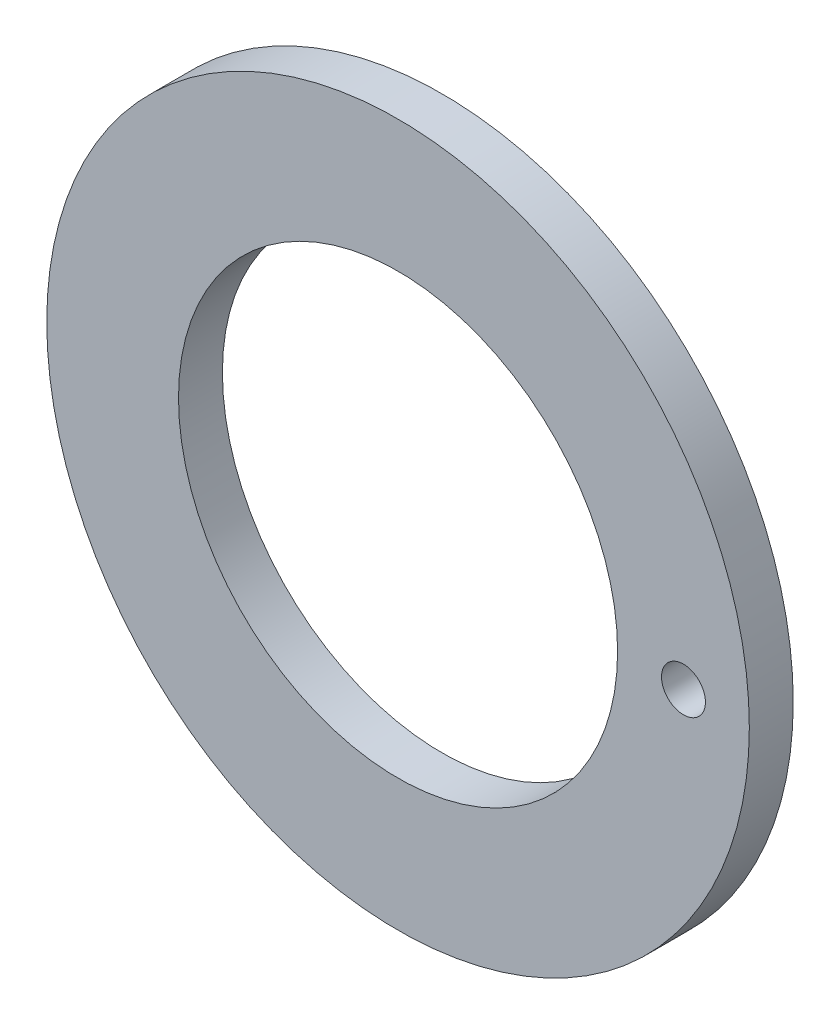
from build123d import *

# Parameters (mm, degrees)
SKETCH5_R           = 12
SKETCH5_R_2         = 7.5
BODY_EXTRUDE_DEPTH  = 0.75
HOLE_CUT_DEPTH      = 17.987127479
HOLE_CUT_DEPTH_BACK = 17.987127479
SKETCH3_R           = 0.75


with BuildPart() as part:
    # Sketch5 → Body Extrude (new, symmetric)
    with BuildSketch(Plane.XY):
        Circle(SKETCH5_R)
        Circle(SKETCH5_R_2, mode=Mode.SUBTRACT)
    extrude(amount=BODY_EXTRUDE_DEPTH, both=True)

    # Sketch3 → Hole Cut (cut, two sides: drawn at the far end of the back side and taken through both)
    with BuildSketch(Plane.XY.offset(-HOLE_CUT_DEPTH_BACK)):
        with Locations((9.75, 0)):
            Circle(SKETCH3_R)
    extrude(amount=HOLE_CUT_DEPTH + HOLE_CUT_DEPTH_BACK, mode=Mode.SUBTRACT)


solid = part.part
